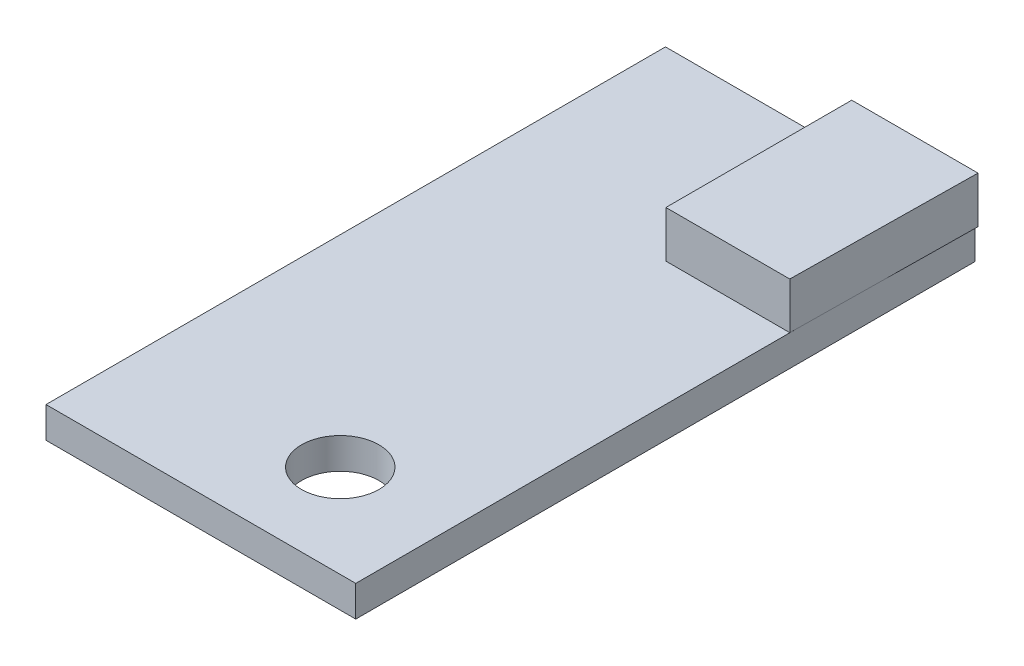
from build123d import *

# Parameters (mm, degrees)
BOSS_EXTRUDE1_DEPTH    = 10
BOSS_EXTRUDE2_DEPTH    = 15
F_25_0MM_DOWEL_HOLE1_D = 25


with BuildPart() as part:
    # Sketch2 → Boss-Extrude1 (new body)
    with BuildSketch(Plane(origin=(0, 0, 0), x_dir=(1, 0, 0), z_dir=(0, 1, 0))):
        Polygon((0, 0), (100.00000548, 0), (100, -200), (0, -200.00001096), align=None)
    extrude(amount=BOSS_EXTRUDE1_DEPTH)

    # Sketch3 → Boss-Extrude2 (add)
    with BuildSketch(Plane(origin=(0.867898509, 10, -1.693868364), x_dir=(1, 0, 0), z_dir=(0, 1, 0))):
        Polygon((59.097520158, -1.533073759), (59.097520158, -61.533073759), (99.097520158, -61.533073759), (99.866800969, -1.533073759), align=None)
    extrude(amount=BOSS_EXTRUDE2_DEPTH)

    # Ø25.0mm Dowel Hole1 (through all)
    with Locations(Plane(origin=(0, 10, 0), x_dir=(1, 0, 0), z_dir=(0, 1, 0))):
        with Locations((65, -170)):
            Hole(F_25_0MM_DOWEL_HOLE1_D / 2)


solid = part.part
